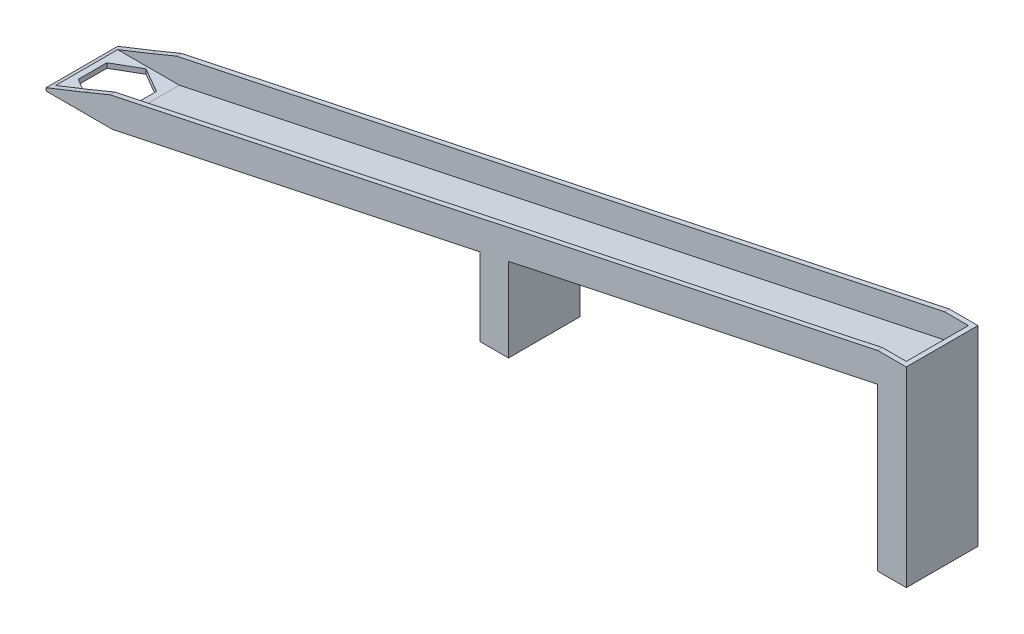
from build123d import *

# Parameters (mm, degrees)
BOSS_EXTRUDE2_DEPTH = 75
SHELL1_T            = -5
CUT_EXTRUDE2_DEPTH  = 60
CUT_EXTRUDE4_DEPTH  = 90
SKETCH12_W          = 30
SKETCH12_H          = 169.335306301
BOSS_EXTRUDE5_DEPTH = 75


with BuildPart() as part:
    # Sketch2 → Boss-Extrude2 (new body)
    with BuildSketch(Plane.XY):
        Polygon((0, 0), (70, 0), (870, 169.335306301), (900, 169.335306301), (900, 200), (870, 200), (66.859751398, 30), (0, 30), align=None)
    extrude(amount=BOSS_EXTRUDE2_DEPTH)

    # Shell1
    shell1_openings = [part.faces().sort_by_distance(p)[0] for p in [
        (33.429875699, 30, 37.5),
        (468.429875699, 115, 37.5),
        (885, 200, 37.5),
    ]]
    offset(amount=SHELL1_T, openings=shell1_openings, kind=Kind.INTERSECTION)

    # Sketch9 → Cut-Extrude2 (cut)
    with BuildSketch(Plane(origin=(0, 5, 0), x_dir=(1, 0, 0), z_dir=(0, 1, 0))):
        Polygon((37.210185308, -7.581831093), (11.229423195, -22.581831093), (11.229423195, -52.581831093), (37.210185308, -67.581831093), (63.190947422, -52.581831093), (63.190947422, -22.581831093), align=None)
    extrude(amount=-CUT_EXTRUDE2_DEPTH, mode=Mode.SUBTRACT)

    # Sketch11 → Cut-Extrude4 (cut)
    with BuildSketch(Plane.XY.offset(75)):
        Polygon((66.859751398, 30), (40.895726077, 19.305163659), (0, 3), (0, 30), align=None)
    extrude(amount=-CUT_EXTRUDE4_DEPTH, mode=Mode.SUBTRACT)

    # Sketch12 → Boss-Extrude5 (add)
    with BuildSketch(Plane.XY.offset(75)):
        with Locations((885, 84.667653151)):
            Rectangle(SKETCH12_W, SKETCH12_H)
        Polygon((453.833635791, 81.245732857), (453.833635791, 0), (483.833635791, 0), (483.833635791, 87.595806843), align=None)
    extrude(amount=-BOSS_EXTRUDE5_DEPTH)


solid = part.part
